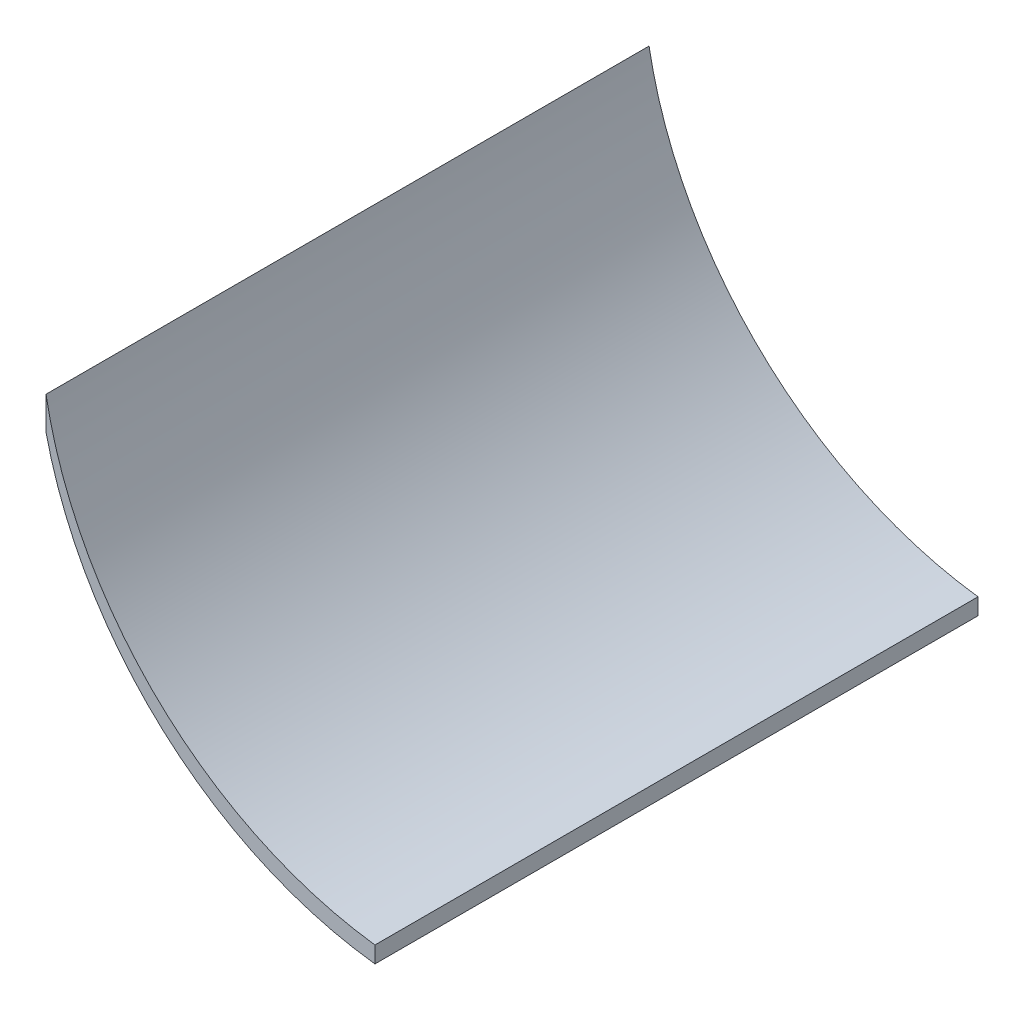
from build123d import *

# Parameters (mm, degrees)
BOSS_EXTRUDE1_DEPTH = 139.7


with BuildPart() as part:
    # Sketch1 → Boss-Extrude1 (new body)
    with BuildSketch(Plane.XY):
        with BuildLine():
            Line((0, 0), (0, 7.62))
            ThreePointArc((0, 7.62), (26.256544534, -41.041795227), (76.2, -64.77))
            Line((76.2, -64.77), (76.2, -68.58))
            ThreePointArc((76.2, -68.58), (27.219070709, -46.379921434), (0, 0))
        make_face()
    extrude(amount=BOSS_EXTRUDE1_DEPTH)


solid = part.part
